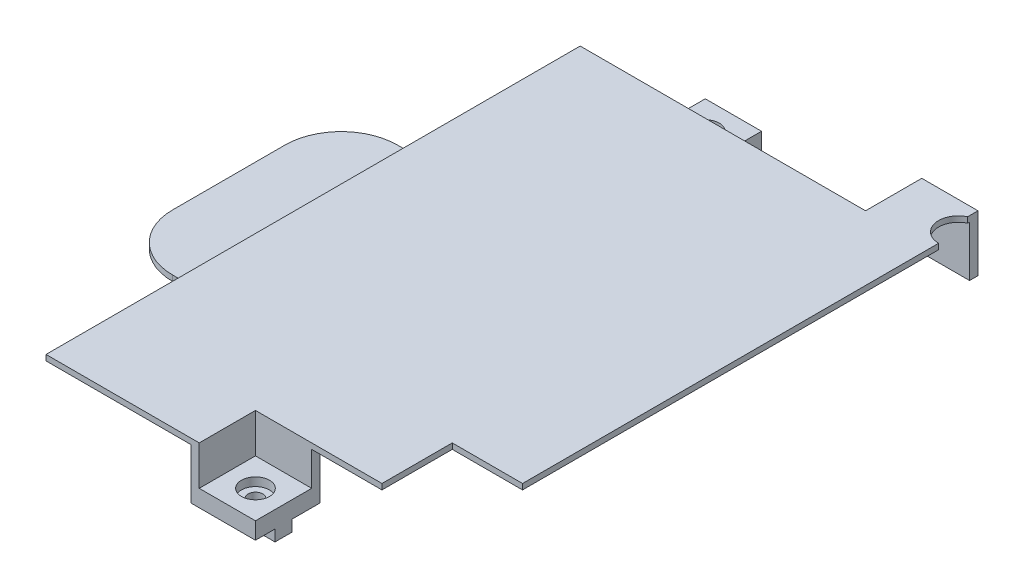
from build123d import *

# Parameters (mm, degrees)
SKETCH_1_W           = 180
SKETCH_1_H           = 170
EXTRUDE_1_DEPTH      = 2
SKETCH_2_W           = 180
SKETCH_2_H           = 2
SKETCH_2_W_2         = 2
SKETCH_2_H_2         = 166
EXTRUDE_2_DEPTH      = 18
SKETCH_4_W           = 20
SKETCH_4_H           = 20
EXTRUDE_3_DEPTH      = 20
SKETCH_5_W           = 20
SKETCH_5_H           = 20
CUT_EXTRUDE_1_DEPTH  = 14
SKETCH_6_W           = 176
SKETCH_6_H           = 166
SKETCH_6_W_2         = 174
SKETCH_6_H_2         = 164
EXTRUDE_4_DEPTH      = 18
SKETCH_7_W           = 20
SKETCH_7_H           = 20
EXTRUDE_5_DEPTH      = 6
SKETCH_8_W           = 3
SKETCH_8_H           = 164
SKETCH_8_H_2         = 3
CUT_EXTRUDE_2_DEPTH  = 18
SKETCH_9_W           = 77
SKETCH_9_H           = 3
CUT_EXTRUDE_3_DEPTH  = 18
SKETCH_10_W          = 25
SKETCH_10_H          = 25
CUT_EXTRUDE_4_DEPTH  = 18
SKETCH_11_W          = 6.95
SKETCH_11_H          = 6.1
EXTRUDE_6_DEPTH      = 4
CUT_EXTRUDE_5_DEPTH  = 6
CUT_EXTRUDE_START    = -3
SKETCH_13_R          = 5
SKETCH_13_R_2        = 2.6
CUT_EXTRUDE_6_DEPTH  = 3
CUT_EXTRUDE_7_DEPTH  = 3
SKETCH_15_R          = 2.6
CUT_EXTRUDE_8_DEPTH  = 3
SKETCH_16_W          = 6.1
SKETCH_16_H          = 6.95
EXTRUDE_7_DEPTH      = 4
CUT_EXTRUDE_9_DEPTH  = 6
SKETCH_18_R          = 5
SKETCH_18_R_2        = 2.6
CUT_EXTRUDE_10_DEPTH = 3
EXTRUDE_8_DEPTH      = 4
SKETCH_20_W          = 30
SKETCH_20_H          = 20
SKETCH_20_W_2        = 80
EXTRUDE_9_DEPTH      = 2
SKETCH_21_W          = 3
SKETCH_21_H          = 20
EXTRUDE_10_DEPTH     = 18
SKETCH_22_W          = 20
SKETCH_22_H          = 20
SKETCH_22_R          = 5
EXTRUDE_11_DEPTH     = 14
SKETCH_23_W          = 30
SKETCH_23_H          = 20
CUT_EXTRUDE_11_DEPTH = 14
SKETCH_24_W          = 20
SKETCH_24_H          = 20
EXTRUDE_12_DEPTH     = 2
SKETCH_25_W          = 20
SKETCH_25_H          = 3
CUT_EXTRUDE_12_DEPTH = 18
CUT_EXTRUDE_13_DEPTH = 18
SKETCH_27_W          = 3
SKETCH_27_H          = 20
EXTRUDE_13_DEPTH     = 20
SKETCH_28_W          = 23
SKETCH_28_H          = 3
EXTRUDE_14_DEPTH     = 20
SKETCH_29_W          = 3
SKETCH_29_H          = 5
CUT_EXTRUDE_14_DEPTH = 20
SKETCH_30_W          = 20
SKETCH_30_H          = 20
CUT_EXTRUDE_15_DEPTH = 30
SKETCH_31_W          = 3
SKETCH_31_H          = 190
EXTRUDE_15_DEPTH     = 20
EXTRUDE_START        = -2
EXTRUDE_16_DEPTH     = 2
SKETCH_33_W          = 40
SKETCH_33_H          = 80
CUT_EXTRUDE_16_DEPTH = 2
SKETCH_34_W          = 44.5
SKETCH_34_H          = 20
CUT_EXTRUDE_17_DEPTH = 30
SKETCH_35_W          = 20
SKETCH_35_H          = 3
CUT_EXTRUDE_18_DEPTH = 18
EXTRUDE_17_DEPTH     = 20
CUT_EXTRUDE_19_DEPTH = 20
SKETCH_38_R          = 5
CUT_EXTRUDE_20_DEPTH = 17
SKETCH_39_W          = 20
SKETCH_39_H          = 20
CUT_EXTRUDE_21_DEPTH = 14
SKETCH_40_W          = 54.5
SKETCH_40_H          = 20
EXTRUDE_18_DEPTH     = 2
SKETCH_42_W          = 3
SKETCH_42_H          = 23
EXTRUDE_20_DEPTH     = 18
SKETCH_44_W          = 9.95
SKETCH_44_H          = 6.1
SKETCH_44_W_2        = 6.95
EXTRUDE_21_DEPTH     = 4


with BuildPart() as part:
    # 草图1 → 凸台-拉伸1 (new body)
    with BuildSketch(Plane(origin=(0, 0, 0), x_dir=(1, 0, 0), z_dir=(0, 1, 0))):
        Rectangle(SKETCH_1_W, SKETCH_1_H)
    extrude(amount=EXTRUDE_1_DEPTH)

    # 草图2 → 凸台-拉伸2 (add)
    with BuildSketch(Plane(origin=(0, 0, 0), x_dir=(1, 0, 0), z_dir=(0, 1, 0))):
        with Locations((0, 84)):
            Rectangle(SKETCH_2_W, SKETCH_2_H)
        Polygon((-88, 83), (-90, 83), (-90, -85), (-88, -85), (-88, -83), align=None)
        with Locations((89, 0)):
            Rectangle(SKETCH_2_W_2, SKETCH_2_H_2)
        Polygon((90, -85), (90, -83), (88, -83), (-88, -83), (-88, -85), align=None)
    extrude(amount=-EXTRUDE_2_DEPTH)

    # 草图4 → 凸台-拉伸3 (add)
    with BuildSketch(Plane(origin=(0, 2, 0), x_dir=(1, 0, 0), z_dir=(0, 1, 0))):
        Polygon((10, -85), (0, -85), (-10, -85), (-10, -95), (-10, -105), (10, -105), (10, -95), align=None)
        with Locations((-100, 0)):
            Rectangle(SKETCH_4_W, SKETCH_4_H)
    extrude(amount=-EXTRUDE_3_DEPTH)

    # 草图5 → 切除-拉伸1 (cut)
    with BuildSketch(Plane(origin=(0, 2, 0), x_dir=(1, 0, 0), z_dir=(0, 1, 0))):
        with Locations((-100, 0)):
            Rectangle(SKETCH_5_W, SKETCH_5_H)
        with Locations((0, -95)):
            Rectangle(SKETCH_5_W, SKETCH_5_H)
    extrude(amount=-CUT_EXTRUDE_1_DEPTH, mode=Mode.SUBTRACT)

    # 草图6 → 凸台-拉伸4 (add)
    with BuildSketch(Plane.XZ):
        Rectangle(SKETCH_6_W, SKETCH_6_H)
        Rectangle(SKETCH_6_W_2, SKETCH_6_H_2, mode=Mode.SUBTRACT)
    extrude(amount=EXTRUDE_4_DEPTH)

    # 草图7 → 凸台-拉伸5 (add)
    with BuildSketch(Plane(origin=(0, -18, 0), x_dir=(-1, 0, 0), z_dir=(0, -1, 0))):
        with Locations((0, 95)):
            Rectangle(SKETCH_7_W, SKETCH_7_H)
    extrude(amount=-EXTRUDE_5_DEPTH)

    # 草图8 → 切除-拉伸2 (cut)
    with BuildSketch(Plane(origin=(0, -18, 0), x_dir=(-1, 0, 0), z_dir=(0, -1, 0))):
        with Locations((-88.5, 0)):
            Rectangle(SKETCH_8_W, SKETCH_8_H)
        with Locations((-88.5, -83.5)):
            Rectangle(SKETCH_8_W, SKETCH_8_H_2)
    extrude(amount=-CUT_EXTRUDE_2_DEPTH, mode=Mode.SUBTRACT)

    # 草图9 → 切除-拉伸3 (cut)
    with BuildSketch(Plane(origin=(0, -18, 0), x_dir=(-1, 0, 0), z_dir=(0, -1, 0))):
        with Locations((-48.5, -83.5)):
            Rectangle(SKETCH_9_W, SKETCH_9_H)
        with Locations((48.5, -83.5)):
            Rectangle(SKETCH_9_W, SKETCH_9_H)
    extrude(amount=-CUT_EXTRUDE_3_DEPTH, mode=Mode.SUBTRACT)

    # 草图10 → 切除-拉伸4 (cut)
    with BuildSketch(Plane(origin=(0, 2, 0), x_dir=(1, 0, 0), z_dir=(0, 1, 0))):
        with Locations((77.5, -72.5)):
            Rectangle(SKETCH_10_W, SKETCH_10_H)
    extrude(amount=-CUT_EXTRUDE_4_DEPTH, mode=Mode.SUBTRACT)

    # 草图11 → 凸台-拉伸6 (add)
    with BuildSketch(Plane(origin=(0, -18, 0), x_dir=(-1, 0, 0), z_dir=(0, -1, 0))):
        Polygon((-3.05, 91.95), (-3.05, 98.05), (-10, 98.05), (-10, 95), (-10, 91.95), align=None)
        with Locations((6.525, 95)):
            Rectangle(SKETCH_11_W, SKETCH_11_H)
    extrude(amount=EXTRUDE_6_DEPTH)

    # 草图12 → 切除-拉伸5 (cut)
    with BuildSketch(Plane(origin=(0, -18, 0), x_dir=(-1, 0, 0), z_dir=(0, -1, 0))):
        with BuildLine():
            ThreePointArc((-1.838477631, 96.838477631), (-1.838477631, 93.161522369), (1.838477631, 93.161522369))
            Line((1.838477631, 93.161522369), (-1.838477631, 96.838477631))
        make_face()
        with BuildLine():
            Line((-1.838477631, 96.838477631), (1.838477631, 93.161522369))
            ThreePointArc((1.838477631, 93.161522369), (2.402086785, 94.005023076), (2.6, 95))
            ThreePointArc((2.6, 95), (0.994976924, 97.402086785), (-1.838477631, 96.838477631))
        make_face()
    extrude(amount=-CUT_EXTRUDE_5_DEPTH, mode=Mode.SUBTRACT)

    # 草图13 → 切除-拉伸6 (cut)
    with BuildSketch(Plane(origin=(0, -12, 0), x_dir=(1, 0, 0), z_dir=(0, 1, 0)).offset(CUT_EXTRUDE_START)):
        with Locations(Location((0, 95, 0), (0, 0, 270))):
            Circle(SKETCH_13_R)
        with Locations(Location((0, 95, 0), (0, 0, 90))):
            Circle(SKETCH_13_R_2, mode=Mode.SUBTRACT)
    extrude(amount=CUT_EXTRUDE_6_DEPTH, mode=Mode.SUBTRACT)

    # 草图14 → 切除-拉伸7 (cut)
    with BuildSketch(Plane(origin=(0, -12, 0), x_dir=(1, 0, 0), z_dir=(0, 1, 0))):
        with BuildLine():
            ThreePointArc((-96.464466094, 3.535533906), (-103.535533906, 3.535533906), (-103.535533906, -3.535533906))
            Line((-103.535533906, -3.535533906), (-96.464466094, 3.535533906))
        make_face()
        with BuildLine():
            Line((-96.464466094, 3.535533906), (-103.535533906, -3.535533906))
            ThreePointArc((-103.535533906, -3.535533906), (-98.086582838, -4.619397663), (-95, 0))
            ThreePointArc((-95, 0), (-95.380602337, 1.913417162), (-96.464466094, 3.535533906))
        make_face()
    extrude(amount=-CUT_EXTRUDE_7_DEPTH, mode=Mode.SUBTRACT)

    # 草图15 → 切除-拉伸8 (cut)
    with BuildSketch(Plane(origin=(0, -15, 0), x_dir=(1, 0, 0), z_dir=(0, 1, 0))):
        with Locations(Location((-100, 0, 0), (0, 0, 270))):
            Circle(SKETCH_15_R)
    extrude(amount=-CUT_EXTRUDE_8_DEPTH, mode=Mode.SUBTRACT)

    # 草图16 → 凸台-拉伸7 (add)
    with BuildSketch(Plane.XZ.offset(18)):
        Polygon((-96.95, -3.05), (-100, -3.05), (-103.05, -3.05), (-103.05, -10), (-96.95, -10), align=None)
        with Locations((-100, 6.525)):
            Rectangle(SKETCH_16_W, SKETCH_16_H)
    extrude(amount=EXTRUDE_7_DEPTH)

    # 草图17 → 切除-拉伸9 (cut)
    with BuildSketch(Plane(origin=(0, -18, 0), x_dir=(-1, 0, 0), z_dir=(0, -1, 0))):
        with BuildLine():
            ThreePointArc((2.6, -95), (0.994976924, -92.597913215), (-1.838477631, -93.161522369))
            Line((-1.838477631, -93.161522369), (1.838477631, -96.838477631))
            ThreePointArc((1.838477631, -96.838477631), (2.402086785, -95.994976924), (2.6, -95))
        make_face()
        with BuildLine():
            Line((1.838477631, -96.838477631), (-1.838477631, -93.161522369))
            ThreePointArc((-1.838477631, -93.161522369), (-1.838477631, -96.838477631), (1.838477631, -96.838477631))
        make_face()
    extrude(amount=-CUT_EXTRUDE_9_DEPTH, mode=Mode.SUBTRACT)

    # 草图18 → 切除-拉伸10 (cut)
    with BuildSketch(Plane(origin=(0, -12, 0), x_dir=(1, 0, 0), z_dir=(0, 1, 0)).offset(CUT_EXTRUDE_START)):
        with Locations(Location((0, -95, 0), (0, 0, 270))):
            Circle(SKETCH_18_R)
        with Locations(Location((0, -95, 0), (0, 0, 90))):
            Circle(SKETCH_18_R_2, mode=Mode.SUBTRACT)
    extrude(amount=CUT_EXTRUDE_10_DEPTH, mode=Mode.SUBTRACT)

    # 草图19 → 凸台-拉伸8 (add)
    with BuildSketch(Plane(origin=(0, -18, 0), x_dir=(-1, 0, 0), z_dir=(0, -1, 0))):
        Polygon((3.05, -91.95), (3.05, -95), (3.05, -98.05), (10, -98.05), (10, -91.95), align=None)
        Polygon((-3.05, -98.05), (-3.05, -95), (-3.05, -91.95), (-10, -91.95), (-10, -98.05), align=None)
    extrude(amount=EXTRUDE_8_DEPTH)

    # 草图20 → 凸台-拉伸9 (add)
    with BuildSketch(Plane(origin=(0, 2, 0), x_dir=(1, 0, 0), z_dir=(0, 1, 0))):
        with Locations((25, -95)):
            Rectangle(SKETCH_20_W, SKETCH_20_H)
        with Locations((-50, -95)):
            Rectangle(SKETCH_20_W_2, SKETCH_20_H)
    extrude(amount=-EXTRUDE_9_DEPTH)

    # 草图21 → 凸台-拉伸10 (add)
    with BuildSketch(Plane(origin=(0, 0, 0), x_dir=(-1, 0, 0), z_dir=(0, -1, 0))):
        with Locations((88.5, -95)):
            Rectangle(SKETCH_21_W, SKETCH_21_H)
    extrude(amount=EXTRUDE_10_DEPTH)

    # 草图22 → 凸台-拉伸11 (add)
    with BuildSketch(Plane(origin=(0, -12, 0), x_dir=(1, 0, 0), z_dir=(0, 1, 0))):
        with Locations((0, -95)):
            Rectangle(SKETCH_22_W, SKETCH_22_H)
        with Locations(Location((0, -95, 0), (0, 0, 270))):
            Circle(SKETCH_22_R, mode=Mode.SUBTRACT)
    extrude(amount=EXTRUDE_11_DEPTH)

    # 草图23 → 切除-拉伸11 (cut)
    with BuildSketch(Plane(origin=(0, 0, 0), x_dir=(-1, 0, 0), z_dir=(0, -1, 0))):
        with Locations((-25, -95)):
            Rectangle(SKETCH_23_W, SKETCH_23_H)
    extrude(amount=-CUT_EXTRUDE_11_DEPTH, mode=Mode.SUBTRACT)

    # 草图24 → 凸台-拉伸12 (add)
    with BuildSketch(Plane(origin=(0, 2, 0), x_dir=(1, 0, 0), z_dir=(0, 1, 0))):
        with Locations((80, 95)):
            Rectangle(SKETCH_24_W, SKETCH_24_H)
    extrude(amount=-EXTRUDE_12_DEPTH)

    # 草图25 → 切除-拉伸12 (cut)
    with BuildSketch(Plane(origin=(0, -18, 0), x_dir=(-1, 0, 0), z_dir=(0, -1, 0))):
        with Locations((-80, 83.5)):
            Rectangle(SKETCH_25_W, SKETCH_25_H)
    extrude(amount=-CUT_EXTRUDE_12_DEPTH, mode=Mode.SUBTRACT)

    # 草图26 → 切除-拉伸13 (cut)
    with BuildSketch(Plane.XZ):
        with BuildLine():
            ThreePointArc((90, -88), (83, -95), (90, -102))
            Line((90, -102), (90, -95))
            Line((90, -95), (90, -88))
        make_face()
    extrude(amount=-CUT_EXTRUDE_13_DEPTH, mode=Mode.SUBTRACT)

    # 草图27 → 凸台-拉伸13 (add)
    with BuildSketch(Plane(origin=(0, 2, 0), x_dir=(1, 0, 0), z_dir=(0, 1, 0))):
        with Locations((68.5, 95)):
            Rectangle(SKETCH_27_W, SKETCH_27_H)
    extrude(amount=-EXTRUDE_13_DEPTH)

    # 草图28 → 凸台-拉伸14 (add)
    with BuildSketch(Plane(origin=(0, 2, 0), x_dir=(1, 0, 0), z_dir=(0, 1, 0))):
        with Locations((78.5, 103.5)):
            Rectangle(SKETCH_28_W, SKETCH_28_H)
    extrude(amount=-EXTRUDE_14_DEPTH)

    # 草图29 → 切除-拉伸14 (cut)
    with BuildSketch(Plane(origin=(0, 2, 0), x_dir=(1, 0, 0), z_dir=(0, 1, 0))):
        with Locations((88.5, 102.5)):
            Rectangle(SKETCH_29_W, SKETCH_29_H)
    extrude(amount=-CUT_EXTRUDE_14_DEPTH, mode=Mode.SUBTRACT)

    # 草图30 → 切除-拉伸15 (cut)
    with BuildSketch(Plane(origin=(0, 2, 0), x_dir=(1, 0, 0), z_dir=(0, 1, 0))):
        with BuildLine():
            Line((-34.5, 40), (-34.5, 85))
            Line((-34.5, 85), (-90, 85))
            Line((-90, 85), (-90, 10))
            Line((-90, 10), (-90, -10))
            Line((-90, -10), (-90, -105))
            Line((-90, -105), (-34.5, -105))
            Line((-34.5, -105), (-34.5, -85))
            Line((-34.5, -85), (-34.5, -40))
            Line((-34.5, -40), (-54.5, -40))
            ThreePointArc((-54.5, -40), (-68.642135624, -34.142135624), (-74.5, -20))
            Line((-74.5, -20), (-74.5, 20))
            ThreePointArc((-74.5, 20), (-68.642135624, 34.142135624), (-54.5, 40))
            Line((-54.5, 40), (-34.5, 40))
        make_face()
        with Locations((-100, 0)):
            Rectangle(SKETCH_30_W, SKETCH_30_H)
    extrude(amount=-CUT_EXTRUDE_15_DEPTH, mode=Mode.SUBTRACT)

    # 草图31 → 凸台-拉伸15 (add)
    with BuildSketch(Plane(origin=(0, 2, 0), x_dir=(1, 0, 0), z_dir=(0, 1, 0))):
        with Locations((-33, -10)):
            Rectangle(SKETCH_31_W, SKETCH_31_H)
    extrude(amount=-EXTRUDE_15_DEPTH)

    # 草图32 → 凸台-拉伸16 (add)
    with BuildSketch(Plane(origin=(0, -18, 0), x_dir=(-1, 0, 0), z_dir=(0, -1, 0)).offset(EXTRUDE_START)):
        with BuildLine():
            Line((34.5, -40), (54.5, -40))
            ThreePointArc((54.5, -40), (68.642135624, -34.142135624), (74.5, -20))
            Line((74.5, -20), (74.5, 20))
            ThreePointArc((74.5, 20), (68.642135624, 34.142135624), (54.5, 40))
            Line((54.5, 40), (34.5, 40))
            Line((34.5, 40), (34.5, -40))
        make_face()
    extrude(amount=EXTRUDE_16_DEPTH)

    # 草图33 → 切除-拉伸16 (cut)
    with BuildSketch(Plane(origin=(0, 2, 0), x_dir=(1, 0, 0), z_dir=(0, 1, 0))):
        with Locations((-54.5, 0)):
            Rectangle(SKETCH_33_W, SKETCH_33_H)
    extrude(amount=-CUT_EXTRUDE_16_DEPTH, mode=Mode.SUBTRACT)

    # 草图34 → 切除-拉伸17 (cut)
    with BuildSketch(Plane(origin=(0, 2, 0), x_dir=(1, 0, 0), z_dir=(0, 1, 0))):
        with Locations((-12.25, -95)):
            Rectangle(SKETCH_34_W, SKETCH_34_H)
    extrude(amount=-CUT_EXTRUDE_17_DEPTH, mode=Mode.SUBTRACT)

    # 草图35 → 切除-拉伸18 (cut)
    with BuildSketch(Plane(origin=(0, -18, 0), x_dir=(-1, 0, 0), z_dir=(0, -1, 0))):
        with Locations((0, -83.5)):
            Rectangle(SKETCH_35_W, SKETCH_35_H)
    extrude(amount=-CUT_EXTRUDE_18_DEPTH, mode=Mode.SUBTRACT)

    # 草图36 → 凸台-拉伸17 (add)
    with BuildSketch(Plane(origin=(0, 2, 0), x_dir=(1, 0, 0), z_dir=(0, 1, 0))):
        Polygon((40, -105), (40, -85), (40, -82), (20, -82), (20, -85), (20, -105), align=None)
    extrude(amount=-EXTRUDE_17_DEPTH)

    # 草图37 → 切除-拉伸19 (cut)
    with BuildSketch(Plane(origin=(0, 2, 0), x_dir=(1, 0, 0), z_dir=(0, 1, 0))):
        with BuildLine():
            ThreePointArc((32.6, -95), (30.994976924, -92.597913215), (28.161522369, -93.161522369))
            Line((28.161522369, -93.161522369), (31.838477631, -96.838477631))
            ThreePointArc((31.838477631, -96.838477631), (32.402086785, -95.994976924), (32.6, -95))
        make_face()
        with BuildLine():
            Line((31.838477631, -96.838477631), (28.161522369, -93.161522369))
            ThreePointArc((28.161522369, -93.161522369), (28.161522369, -96.838477631), (31.838477631, -96.838477631))
        make_face()
    extrude(amount=-CUT_EXTRUDE_19_DEPTH, mode=Mode.SUBTRACT)

    # 草图38 → 切除-拉伸20 (cut)
    with BuildSketch(Plane(origin=(0, 2, 0), x_dir=(1, 0, 0), z_dir=(0, 1, 0))):
        with Locations(Location((30, -95, 0), (0, 0, 270))):
            Circle(SKETCH_38_R)
    extrude(amount=-CUT_EXTRUDE_20_DEPTH, mode=Mode.SUBTRACT)

    # 草图39 → 切除-拉伸21 (cut)
    with BuildSketch(Plane(origin=(0, 2, 0), x_dir=(1, 0, 0), z_dir=(0, 1, 0))):
        with Locations((30, -95)):
            Rectangle(SKETCH_39_W, SKETCH_39_H)
    extrude(amount=-CUT_EXTRUDE_21_DEPTH, mode=Mode.SUBTRACT)

    # 草图40 → 凸台-拉伸18 (add)
    with BuildSketch(Plane(origin=(0, 2, 0), x_dir=(1, 0, 0), z_dir=(0, 1, 0))):
        with Locations((-7.25, -95)):
            Rectangle(SKETCH_40_W, SKETCH_40_H)
    extrude(amount=-EXTRUDE_18_DEPTH)

    # 草图42 → 凸台-拉伸20 (add)
    with BuildSketch(Plane(origin=(0, -18, 0), x_dir=(-1, 0, 0), z_dir=(0, -1, 0))):
        with Locations((-18.5, -93.5)):
            Rectangle(SKETCH_42_W, SKETCH_42_H)
    extrude(amount=-EXTRUDE_20_DEPTH)

    # 草图44 → 凸台-拉伸21 (add)
    with BuildSketch(Plane(origin=(0, -18, 0), x_dir=(-1, 0, 0), z_dir=(0, -1, 0))):
        with Locations((-21.975, -95)):
            Rectangle(SKETCH_44_W, SKETCH_44_H)
        with Locations((-36.525, -95)):
            Rectangle(SKETCH_44_W_2, SKETCH_44_H)
    extrude(amount=EXTRUDE_21_DEPTH)


solid = part.part
